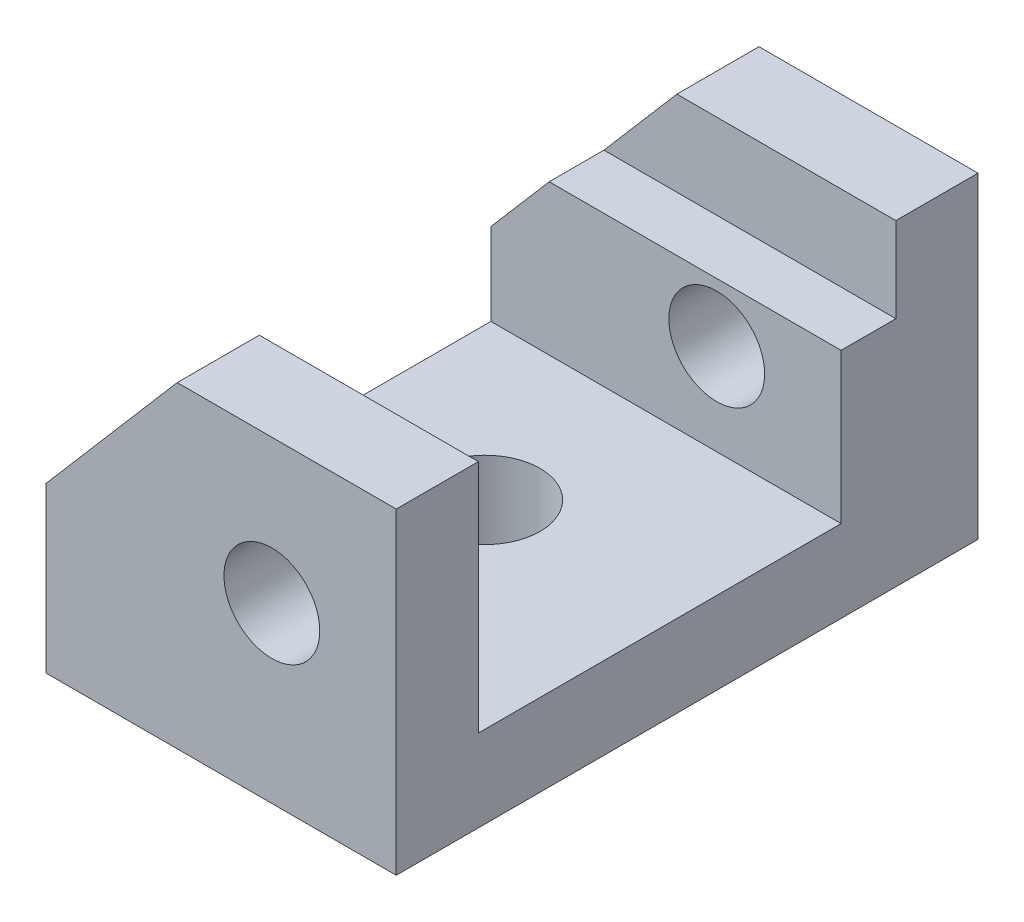
from build123d import *

# Parameters (mm, degrees)
SKETCH_1_R          = 7
EXTRUDE_1_DEPTH     = 85
CUT_EXTRUDE_1_DEPTH = 107.24319241
SKETCH_3_R          = 8
CUT_EXTRUDE_2_DEPTH = 96.804760434


with BuildPart() as part:
    # 스케치1 → 보스-돌출1 (new body)
    with BuildSketch(Plane.XY):
        Polygon((-23.351828972, -14), (-4.179415178, 8.344827586), (27.820584822, 8.344827586), (27.820584822, -38), (-23.351828972, -38), align=None)
        with Locations((9.648171028, -12.655172414)):
            Circle(SKETCH_1_R, mode=Mode.SUBTRACT)
    extrude(amount=EXTRUDE_1_DEPTH)

    # 스케치2 → 컷-돌출1 (cut, through all)
    with BuildSketch(Plane.ZY.offset(23.351828972)):
        Polygon((12, 8.344827586), (12, -4.071985155), (20, -4.071985155), (20, -26), (73, -26), (73, 8.344827586), align=None)
    extrude(amount=-CUT_EXTRUDE_1_DEPTH, mode=Mode.SUBTRACT)

    # 스케치3 → 컷-돌출2 (cut, through all)
    with BuildSketch(Plane(origin=(0, -26, 0), x_dir=(1, 0, 0), z_dir=(0, 1, 0))):
        with Locations(Location((-1.179415178, -43, 0), (0, 0, 270))):
            Circle(SKETCH_3_R)
    extrude(amount=-CUT_EXTRUDE_2_DEPTH, mode=Mode.SUBTRACT)


solid = part.part
